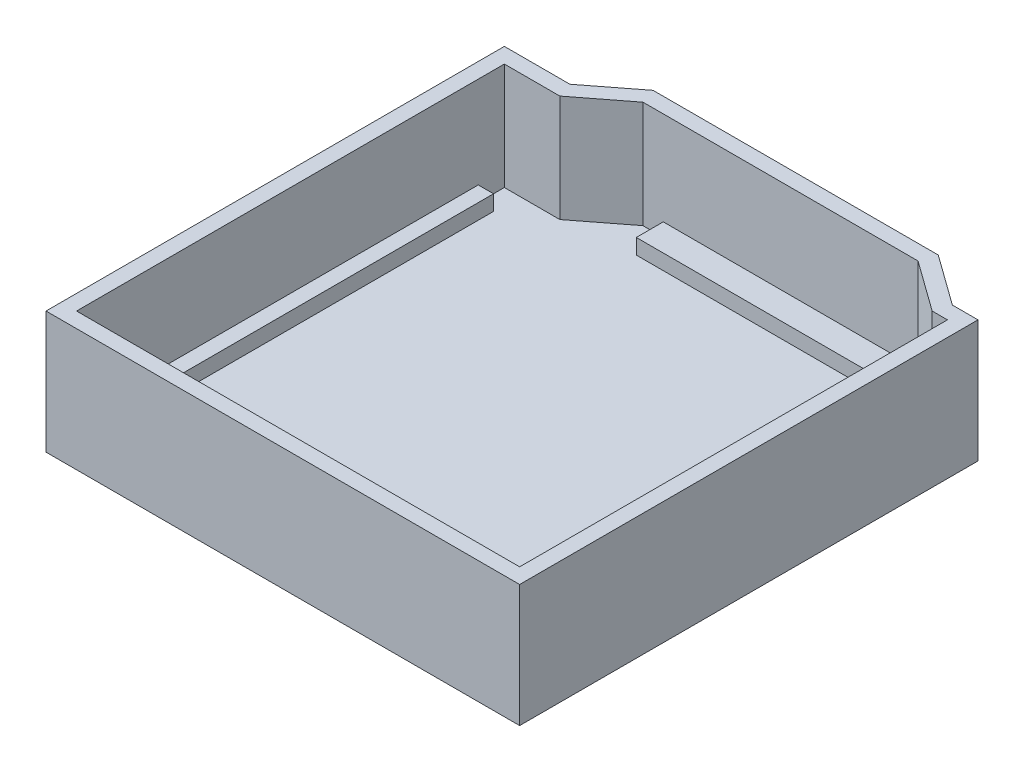
from build123d import *

# Parameters (mm, degrees)
BOSS_EXTRUDE1_DEPTH = 14
SHELL1_T            = 2
SKETCH3_W           = 2
SKETCH3_H           = 50
SKETCH3_W_2         = 1.814522713
BOSS_EXTRUDE2_DEPTH = 2
SKETCH4_W           = 31.017616101
SKETCH4_H           = 3.530460369
BOSS_EXTRUDE3_DEPTH = 2


with BuildPart() as part:
    # Sketch1 → Boss-Extrude1 (new body)
    with BuildSketch(Plane(origin=(0, 0, 0), x_dir=(1, 0, 0), z_dir=(0, 1, 0))):
        Polygon((0, 0), (0, 56), (7.260584432, 56), (13.399361706, 60.750217247), (49.399361706, 60.750217247), (56, 56), (58, 56), (58, 0), align=None)
    extrude(amount=BOSS_EXTRUDE1_DEPTH)

    # Shell1
    shell1_openings = [part.faces().sort_by_distance(p)[0] for p in [
        (29.147078279, 14, -29.765448683),
    ]]
    offset(amount=SHELL1_T, openings=shell1_openings, kind=Kind.INTERSECTION)

    # Sketch3 → Boss-Extrude2 (add)
    with BuildSketch(Plane(origin=(0, 0, 0), x_dir=(1, 0, 0), z_dir=(0, 1, 0))):
        with Locations((1, 27.58353092)):
            Rectangle(SKETCH3_W, SKETCH3_H)
        with Locations((56.968981121, 27.58353092)):
            Rectangle(SKETCH3_W_2, SKETCH3_H)
    extrude(amount=BOSS_EXTRUDE2_DEPTH)

    # Sketch4 → Boss-Extrude3 (add)
    with BuildSketch(Plane(origin=(0, 0, 0), x_dir=(1, 0, 0), z_dir=(0, 1, 0))):
        with Locations((31.80262956, 58.741489624)):
            Rectangle(SKETCH4_W, SKETCH4_H)
    extrude(amount=BOSS_EXTRUDE3_DEPTH)


solid = part.part
